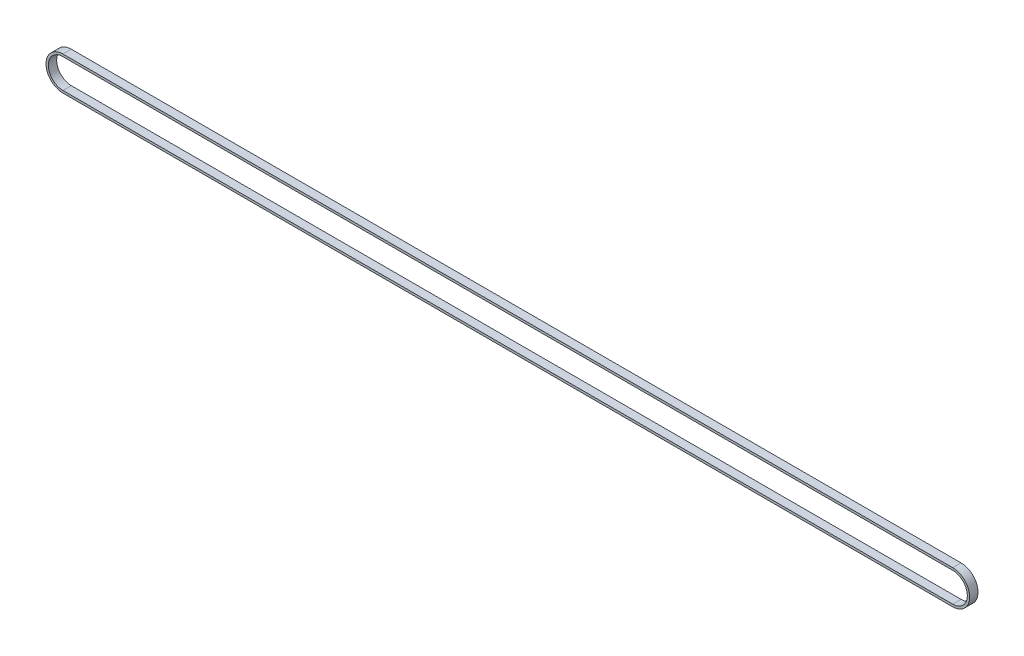
from build123d import *

# Parameters (mm, degrees)
EXTRUDE_THIN1_DEPTH = 2.5


with BuildPart() as part:
    # Sketch1 → Extrude-Thin1 (new, symmetric)
    with BuildSketch(Plane.XY):
        with BuildLine():
            Line((532, -10.13), (0, -10.13))
            ThreePointArc((0, -10.13), (-10.13, 0), (0, 10.13))
            Line((0, 10.13), (532, 10.13))
            ThreePointArc((532, 10.13), (542.13, 0), (532, -10.13))
        make_face()
        with BuildLine():
            Line((532, -8.75), (0, -8.75))
            ThreePointArc((0, -8.75), (-8.75, 0), (0, 8.75))
            Line((0, 8.75), (532, 8.75))
            ThreePointArc((532, 8.75), (540.75, 0), (532, -8.75))
        make_face(mode=Mode.SUBTRACT)
    extrude(amount=EXTRUDE_THIN1_DEPTH, both=True)


solid = part.part
